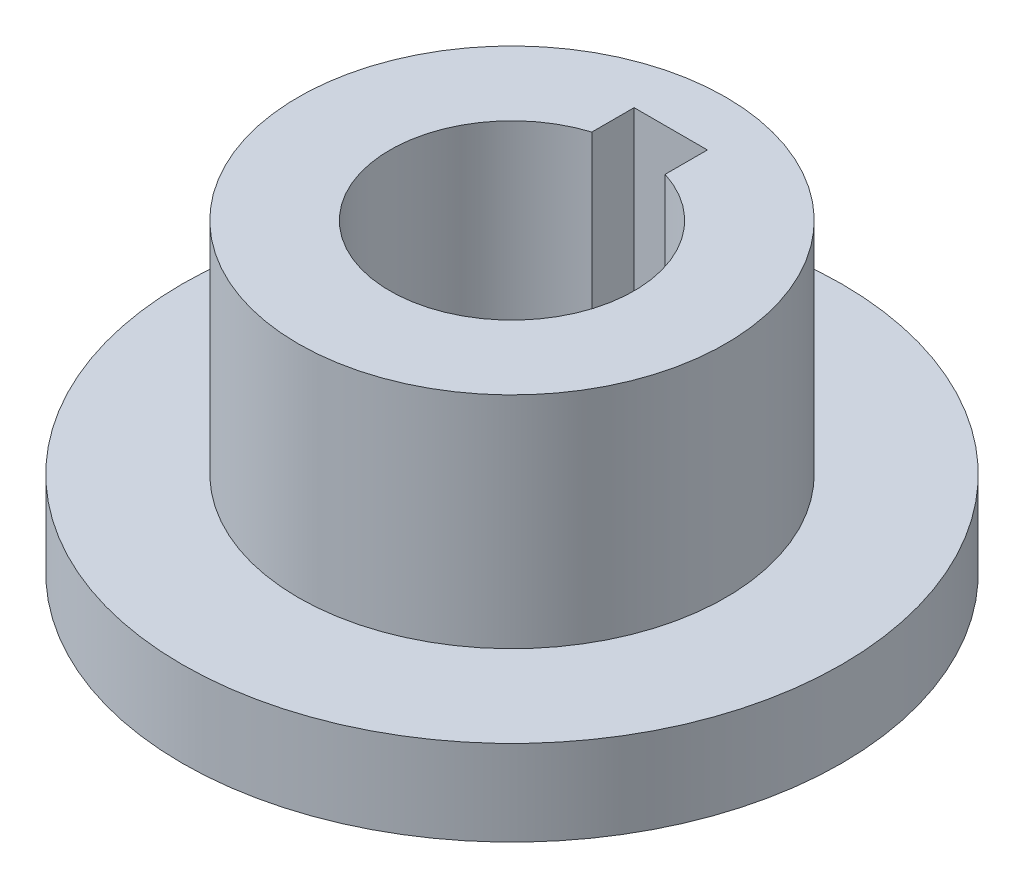
from build123d import *

# Parameters (mm, degrees)
SKETCH_2_W          = 6
SKETCH_2_H          = 8.902136115
CUT_EXTRUDE_1_DEPTH = 46.639894829


with BuildPart() as part:
    # 草图1 → 旋转1 (revolve)
    with BuildSketch(Plane.XY, mode=Mode.PRIVATE) as revolve_1_sk:
        Polygon((10, 0), (27, 0), (27, 7), (17.5, 7), (17.5, 25), (10, 25), align=None)
    revolve(revolve_1_sk.sketch.rotate(Axis((0, 92.857139703, 0), (0, -1, 0)), 90), axis=Axis((0, 92.857139703, 0), (0, -1, 0)))

    # 草图2 → 切除-拉伸1 (cut, through all)
    with BuildSketch(Plane(origin=(0, 25, 0), x_dir=(1, 0, 0), z_dir=(0, 1, 0))):
        with Locations((0, 8.548931943)):
            Rectangle(SKETCH_2_W, SKETCH_2_H)
    extrude(amount=-CUT_EXTRUDE_1_DEPTH, mode=Mode.SUBTRACT)


solid = part.part
